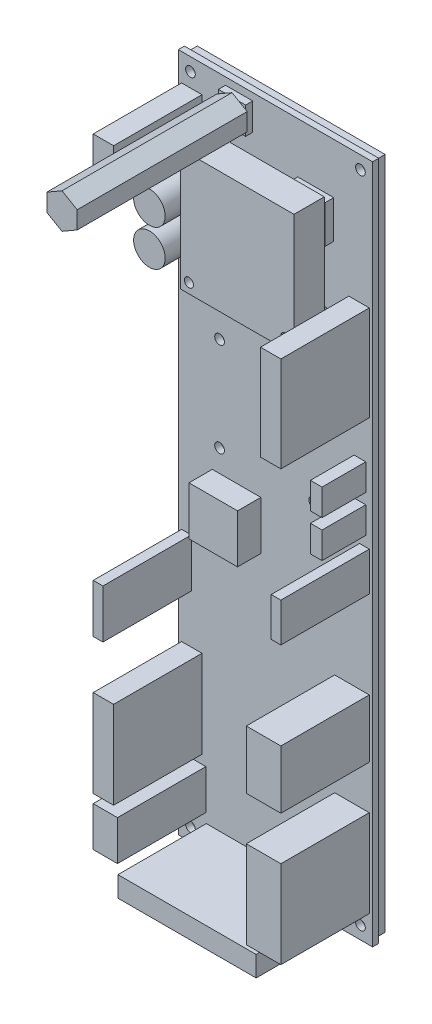
from build123d import *

# Parameters (mm, degrees)
SKETCH3_W             = 50.8
SKETCH3_H             = 177.8
SKETCH3_R             = 1.27
SKETCH3_R_2           = 1.8415
BOSS_EXTRUDE1_DEPTH   = 1.6002
SKETCH4_W             = 5.334
SKETCH4_H             = 10.414
BOSS_EXTRUDE2_DEPTH   = 23.114
SKETCH4_W_2           = 2.54
SKETCH4_H_2           = 12.7
BOSS_EXTRUDE2_2_DEPTH = 23.114
SKETCH4_H_3           = 22.86
BOSS_EXTRUDE2_3_DEPTH = 23.114
SKETCH4_W_3           = 6.35
BOSS_EXTRUDE2_4_DEPTH = 23.114
SKETCH4_W_4           = 36.1442
SKETCH4_H_4           = 5.334
BOSS_EXTRUDE2_5_DEPTH = 23.114
SKETCH4_W_5           = 9.0424
BOSS_EXTRUDE2_6_DEPTH = 23.114
SKETCH4_H_5           = 15.24
BOSS_EXTRUDE2_7_DEPTH = 23.114
SKETCH4_H_6           = 10.16
BOSS_EXTRUDE2_8_DEPTH = 23.114
SKETCH4_H_7           = 24.892
BOSS_EXTRUDE2_9_DEPTH = 23.114
SKETCH5_W             = 3.048
SKETCH5_H             = 6.9342
BOSS_EXTRUDE3_DEPTH   = 11.43
BOSS_EXTRUDE3_2_DEPTH = 11.43
SKETCH6_R             = 4.1275
BOSS_EXTRUDE4_DEPTH   = 12.7
BOSS_EXTRUDE4_2_DEPTH = 12.7
SKETCH7_W             = 12.7
SKETCH7_H             = 12.7
BOSS_EXTRUDE5_DEPTH   = 6.096
SKETCH8_W             = 9.398
SKETCH8_H             = 9.906
BOSS_EXTRUDE6_DEPTH   = 2.286
SKETCH9_W             = 7.112
SKETCH9_H             = 7.112
BOSS_EXTRUDE7_DEPTH   = 1.8542
BOSS_EXTRUDE8_DEPTH   = 44.45
SKETCH11_W            = 49.1236
SKETCH11_H            = 176.1236
SKETCH11_R            = 1.8415
SKETCH11_R_2          = 1.27
BOSS_EXTRUDE9_DEPTH   = 2.54
SKETCH13_W            = 29.718
SKETCH13_H            = 31.75
SKETCH13_R            = 1.1811
BOSS_EXTRUDE10_DEPTH  = 7.9248


with BuildPart() as part:
    # Sketch3 → Boss-Extrude1 (new body)
    with BuildSketch(Plane.XY.offset(-34.925)):
        Rectangle(SKETCH3_W, SKETCH3_H)
        with Locations((22.225, 85.4964)):
            Circle(SKETCH3_R, mode=Mode.SUBTRACT)
        with Locations((-22.225, 85.4964)):
            Circle(SKETCH3_R, mode=Mode.SUBTRACT)
        with Locations((22.225, -85.4964)):
            Circle(SKETCH3_R, mode=Mode.SUBTRACT)
        with Locations((-22.225, -85.4964)):
            Circle(SKETCH3_R, mode=Mode.SUBTRACT)
        with Locations((-14.605, 28.702)):
            Circle(SKETCH3_R, mode=Mode.SUBTRACT)
        with Locations((10.0076, 28.702)):
            Circle(SKETCH3_R, mode=Mode.SUBTRACT)
        with Locations((-14.605, 4.0894)):
            Circle(SKETCH3_R, mode=Mode.SUBTRACT)
        with Locations((10.0076, 4.0894)):
            Circle(SKETCH3_R, mode=Mode.SUBTRACT)
        with Locations((-11.9507, 48.0187)):
            Circle(SKETCH3_R_2, mode=Mode.SUBTRACT)
        with Locations((13.0683, 48.0187)):
            Circle(SKETCH3_R_2, mode=Mode.SUBTRACT)
    extrude(amount=BOSS_EXTRUDE1_DEPTH)


with BuildPart() as body_2:
    # Sketch4 → Boss-Extrude2 (new body)
    with BuildSketch(Plane.XY.offset(-33.3248)):
        with Locations((-21.8694, 76.581)):
            Rectangle(SKETCH4_W, SKETCH4_H)
    extrude(amount=BOSS_EXTRUDE2_DEPTH)


with BuildPart() as body_3:
    # Sketch4 → Boss-Extrude2 2 (new body)
    with BuildSketch(Plane.XY.offset(-33.3248)):
        with Locations((-23.2664, -25.654)):
            Rectangle(SKETCH4_W_2, SKETCH4_H_2)
    extrude(amount=BOSS_EXTRUDE2_2_DEPTH)


with BuildPart() as body_4:
    # Sketch4 → Boss-Extrude2 3 (new body)
    with BuildSketch(Plane.XY.offset(-33.3248)):
        with Locations((-21.8694, -56.134)):
            Rectangle(SKETCH4_W, SKETCH4_H_3)
    extrude(amount=BOSS_EXTRUDE2_3_DEPTH)


with BuildPart() as body_5:
    # Sketch4 → Boss-Extrude2 4 (new body)
    with BuildSketch(Plane.XY.offset(-33.3248)):
        with Locations((-21.3614, -75.057)):
            Rectangle(SKETCH4_W_3, SKETCH4_H)
    extrude(amount=BOSS_EXTRUDE2_4_DEPTH)


with BuildPart() as body_6:
    # Sketch4 → Boss-Extrude2 5 (new body)
    with BuildSketch(Plane.XY.offset(-33.3248)):
        with Locations((0, -85.3694)):
            Rectangle(SKETCH4_W_4, SKETCH4_H_4)
    extrude(amount=BOSS_EXTRUDE2_5_DEPTH)


with BuildPart() as body_7:
    # Sketch4 → Boss-Extrude2 6 (new body)
    with BuildSketch(Plane.XY.offset(-33.3248)):
        with Locations((20.0152, -70.358)):
            Rectangle(SKETCH4_W_5, SKETCH4_H_3)
    extrude(amount=BOSS_EXTRUDE2_6_DEPTH)


with BuildPart() as body_8:
    # Sketch4 → Boss-Extrude2 7 (new body)
    with BuildSketch(Plane.XY.offset(-33.3248)):
        with Locations((20.0152, -39.878)):
            Rectangle(SKETCH4_W_5, SKETCH4_H_5)
    extrude(amount=BOSS_EXTRUDE2_7_DEPTH)


with BuildPart() as body_9:
    # Sketch4 → Boss-Extrude2 8 (new body)
    with BuildSketch(Plane.XY.offset(-33.3248)):
        with Locations((23.2664, -4.318)):
            Rectangle(SKETCH4_W_2, SKETCH4_H_6)
    extrude(amount=BOSS_EXTRUDE2_8_DEPTH)


with BuildPart() as body_10:
    # Sketch4 → Boss-Extrude2 9 (new body)
    with BuildSketch(Plane.XY.offset(-33.3248)):
        with Locations((21.8694, 42.926)):
            Rectangle(SKETCH4_W, SKETCH4_H_7)
    extrude(amount=BOSS_EXTRUDE2_9_DEPTH)


with BuildPart() as body_11:
    # Sketch5 → Boss-Extrude3 (new body)
    with BuildSketch(Plane.XY.offset(-33.3248)):
        with Locations((22.098, 16.5989)):
            Rectangle(SKETCH5_W, SKETCH5_H)
    extrude(amount=BOSS_EXTRUDE3_DEPTH)


with BuildPart() as body_12:
    # Sketch5 → Boss-Extrude3 2 (new body)
    with BuildSketch(Plane.XY.offset(-33.3248)):
        with Locations((22.098, 6.8707)):
            Rectangle(SKETCH5_W, SKETCH5_H)
    extrude(amount=BOSS_EXTRUDE3_2_DEPTH)


with BuildPart() as body_13:
    # Sketch6 → Boss-Extrude4 (new body)
    with BuildSketch(Plane.XY.offset(-33.3248)):
        with Locations((-20.2565, 62.1665)):
            Circle(SKETCH6_R)
    extrude(amount=BOSS_EXTRUDE4_DEPTH)


with BuildPart() as body_14:
    # Sketch6 → Boss-Extrude4 2 (new body)
    with BuildSketch(Plane.XY.offset(-33.3248)):
        with Locations((-20.2565, 52.6415)):
            Circle(SKETCH6_R)
    extrude(amount=BOSS_EXTRUDE4_2_DEPTH)


with BuildPart() as body_15:
    # Sketch7 → Boss-Extrude5 (new body)
    with BuildSketch(Plane.XY.offset(-33.3248)):
        with Locations((-10.16, -8.0518)):
            Rectangle(SKETCH7_W, SKETCH7_H)
    extrude(amount=BOSS_EXTRUDE5_DEPTH)


with BuildPart() as body_16:
    # Sketch8 → Boss-Extrude6 (new body)
    with BuildSketch(Plane.XY.offset(-33.3248)):
        with Locations((10.541, 70.739)):
            Rectangle(SKETCH8_W, SKETCH8_H)
    extrude(amount=BOSS_EXTRUDE6_DEPTH)


with BuildPart() as body_17:
    # Sketch9 → Boss-Extrude7 (new body)
    with BuildSketch(Plane.XY.offset(-33.3248)):
        with Locations((-9.4996, 83.439)):
            Rectangle(SKETCH9_W, SKETCH9_H)
    extrude(amount=BOSS_EXTRUDE7_DEPTH)

    # Sketch10 → Boss-Extrude8 (add)
    with BuildSketch(Plane.XY.offset(-31.4706)):
        Polygon((-5.5245, 81.143974945), (-5.5245, 85.734025055), (-9.4996, 88.02905011), (-13.4747, 85.734025055), (-13.4747, 81.143974945), (-9.4996, 78.84894989), align=None)
    extrude(amount=BOSS_EXTRUDE8_DEPTH)


with BuildPart() as body_18:
    # Sketch11 → Boss-Extrude9 (new body)
    with BuildSketch(Plane(origin=(0, 0, -34.925), x_dir=(-1, 0, 0), z_dir=(0, 0, -1))):
        Rectangle(SKETCH11_W, SKETCH11_H)
        with Locations((-13.0683, 48.0187)):
            Circle(SKETCH11_R, mode=Mode.SUBTRACT)
        with Locations((11.9507, 48.0187)):
            Circle(SKETCH11_R, mode=Mode.SUBTRACT)
        with Locations((-10.0076, 28.702)):
            Circle(SKETCH11_R_2, mode=Mode.SUBTRACT)
        with Locations((14.605, 28.702)):
            Circle(SKETCH11_R_2, mode=Mode.SUBTRACT)
        with Locations((-10.0076, 4.0894)):
            Circle(SKETCH11_R_2, mode=Mode.SUBTRACT)
        with Locations((14.605, 4.0894)):
            Circle(SKETCH11_R_2, mode=Mode.SUBTRACT)
        with Locations((-22.225, -85.4964)):
            Circle(SKETCH11_R_2, mode=Mode.SUBTRACT)
        with Locations((22.225, -85.4964)):
            Circle(SKETCH11_R_2, mode=Mode.SUBTRACT)
        with Locations((22.225, 85.4964)):
            Circle(SKETCH11_R_2, mode=Mode.SUBTRACT)
        with Locations((-22.225, 85.4964)):
            Circle(SKETCH11_R_2, mode=Mode.SUBTRACT)
    extrude(amount=BOSS_EXTRUDE9_DEPTH)


with BuildPart() as body_19:
    # Sketch13 → Boss-Extrude10 (new body)
    with BuildSketch(Plane.XY.offset(-30.7848)):
        with Locations((0.4572, 61.3156)):
            Rectangle(SKETCH13_W, SKETCH13_H)
        with Locations((-12.1539, 48.0187)):
            Circle(SKETCH13_R, mode=Mode.SUBTRACT)
        with Locations((13.0683, 48.0187)):
            Circle(SKETCH13_R, mode=Mode.SUBTRACT)
    extrude(amount=BOSS_EXTRUDE10_DEPTH)


solid = Compound([part.part, body_2.part, body_3.part, body_4.part, body_5.part, body_6.part, body_7.part, body_8.part, body_9.part, body_10.part, body_11.part, body_12.part, body_13.part, body_14.part, body_15.part, body_16.part, body_17.part, body_18.part, body_19.part])
